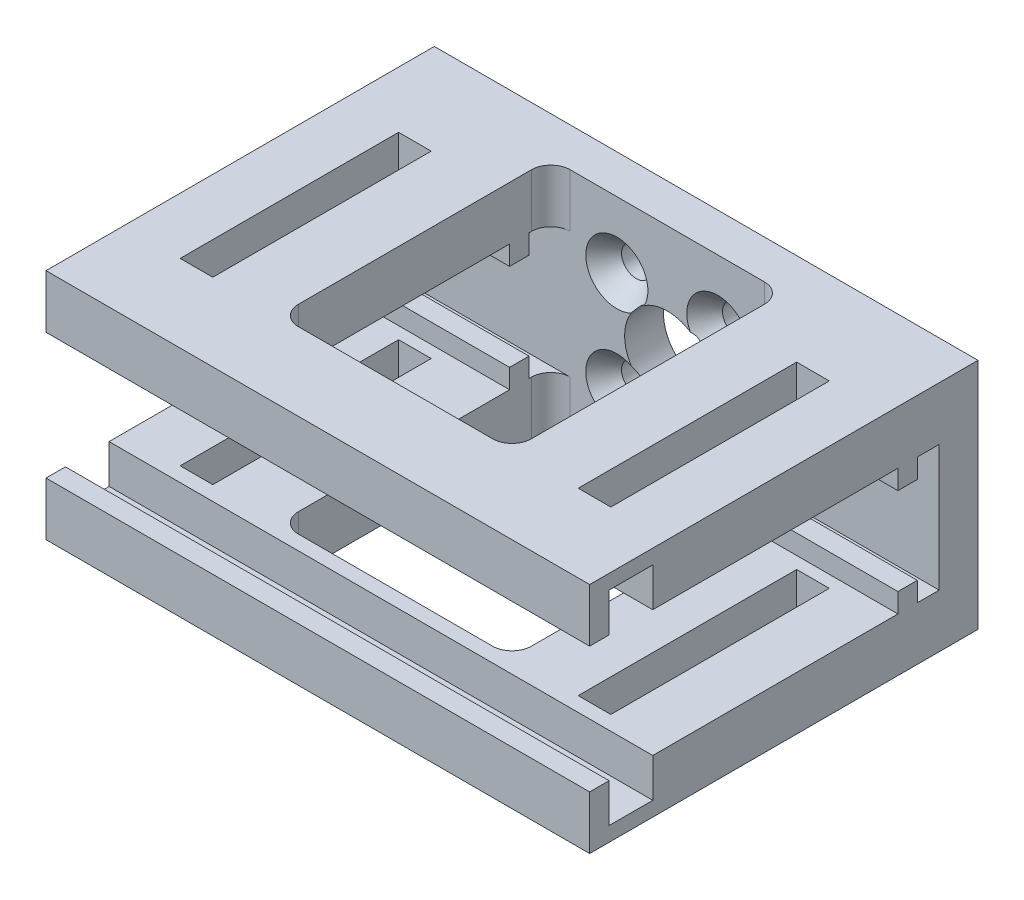
from build123d import *

# Parameters (mm, degrees)
SKETCH1_W           = 88.9
SKETCH1_H           = 63.5
BOSS_EXTRUDE1_DEPTH = 19.05
CUT_EXTRUDE1_DEPTH  = 97.302518139
SKETCH7_W           = 5.334
SKETCH7_H           = 35.71875
SKETCH7_W_2         = 38.1
SKETCH7_H_2         = 44.45
CUT_EXTRUDE4_DEPTH  = 67.599361859
SKETCH4_R           = 6.985
CUT_EXTRUDE3_DEPTH  = 75.865395878
SKETCH6_R           = 2.413
SKETCH5_R           = 5.08
CIRPATTERN1_COUNT   = 4
FILLET1_R           = 3.175


with BuildPart() as part:
    # Sketch1 → Boss-Extrude1 (new, symmetric)
    with BuildSketch(Plane(origin=(0, 0, 0), x_dir=(1, 0, 0), z_dir=(0, 1, 0))):
        Rectangle(SKETCH1_W, SKETCH1_H)
    extrude(amount=BOSS_EXTRUDE1_DEPTH, both=True)

    # Sketch3 → Cut-Extrude1 (cut, through all)
    with BuildSketch(Plane(origin=(44.45, 0, 0), x_dir=(0, 0, -1), z_dir=(1, 0, 0))):
        Polygon((-31.75, 10.31875), (-31.75, -10.31875), (-28.575, -10.31875), (-28.575, -16.66875), (-21.43125, -16.66875), (-21.43125, -10.31875), (18.653125, -10.31875), (18.653125, -7.14375), (21.828125, -7.14375), (21.828125, -10.31875), (25.4, -10.31875), (25.4, 10.31875), (21.828125, 10.31875), (21.828125, 7.14375), (18.653125, 7.14375), (18.653125, 10.31875), (-21.43125, 10.31875), (-21.43125, 16.66875), (-28.575, 16.66875), (-28.575, 10.31875), align=None)
    extrude(amount=-CUT_EXTRUDE1_DEPTH, mode=Mode.SUBTRACT)

    # Sketch7 → Cut-Extrude4 (cut, through all)
    with BuildSketch(Plane(origin=(0, 19.05, 0), x_dir=(1, 0, 0), z_dir=(0, 1, 0))):
        with Locations((-32.54375, -1.190625)):
            Rectangle(SKETCH7_W, SKETCH7_H)
        with Locations((32.54375, -1.190625)):
            Rectangle(SKETCH7_W, SKETCH7_H)
        with Locations((0, 3.175)):
            Rectangle(SKETCH7_W_2, SKETCH7_H_2)
    extrude(amount=-CUT_EXTRUDE4_DEPTH, mode=Mode.SUBTRACT)

    # Sketch4 → Cut-Extrude3 (cut, through all)
    with BuildSketch(Plane.XY.offset(-25.4)):
        Circle(SKETCH4_R)
        with BuildLine():
            ThreePointArc((-5.842, 8.255), (-9.961248663, 9.961248663), (-8.255, 5.842))
            Line((-8.255, 5.842), (-8.255, 8.255))
            Line((-8.255, 8.255), (-5.842, 8.255))
        make_face()
        with BuildLine():
            Line((-8.255, 8.255), (-8.255, 5.842))
            ThreePointArc((-8.255, 5.842), (-6.548751337, 6.548751337), (-5.842, 8.255))
            Line((-5.842, 8.255), (-8.255, 8.255))
        make_face()
        with BuildLine():
            ThreePointArc((5.842, 8.255), (6.548751337, 6.548751337), (8.255, 5.842))
            Line((8.255, 5.842), (8.255, 8.255))
            Line((8.255, 8.255), (5.842, 8.255))
        make_face()
        with BuildLine():
            Line((8.255, 8.255), (8.255, 5.842))
            ThreePointArc((8.255, 5.842), (9.961248663, 6.548751337), (10.668, 8.255))
            ThreePointArc((10.668, 8.255), (8.255, 10.668), (5.842, 8.255))
            Line((5.842, 8.255), (8.255, 8.255))
        make_face()
        with BuildLine():
            ThreePointArc((8.255, -5.842), (6.548751337, -6.548751337), (5.842, -8.255))
            Line((5.842, -8.255), (8.255, -8.255))
            Line((8.255, -8.255), (8.255, -5.842))
        make_face()
        with BuildLine():
            Line((8.255, -8.255), (5.842, -8.255))
            ThreePointArc((5.842, -8.255), (8.255, -10.668), (10.668, -8.255))
            ThreePointArc((10.668, -8.255), (9.961248663, -6.548751337), (8.255, -5.842))
            Line((8.255, -5.842), (8.255, -8.255))
        make_face()
        with BuildLine():
            ThreePointArc((-8.255, -5.842), (-9.961248663, -9.961248663), (-5.842, -8.255))
            Line((-5.842, -8.255), (-8.255, -8.255))
            Line((-8.255, -8.255), (-8.255, -5.842))
        make_face()
        with BuildLine():
            Line((-8.255, -8.255), (-5.842, -8.255))
            ThreePointArc((-5.842, -8.255), (-6.548751337, -6.548751337), (-8.255, -5.842))
            Line((-8.255, -5.842), (-8.255, -8.255))
        make_face()
    extrude(amount=-CUT_EXTRUDE3_DEPTH, mode=Mode.SUBTRACT)

    # Sketch6 → Cut-Loft2 section 0
    with BuildSketch(Plane.XY.offset(-28.575)):
        with Locations((-8.255, 8.255)):
            Circle(SKETCH6_R)
    # Sketch5 → Cut-Loft2 section 1
    with BuildSketch(Plane.XY.offset(-25.4)):
        with Locations((-8.255, 8.255)):
            Circle(SKETCH5_R)
    cut_loft2 = loft(mode=Mode.SUBTRACT)

    # CirPattern1: Cut-Loft2 ×4 about axis
    cirpattern1_axis = Axis((0, 0, 0), (0, 0, 1))
    for i in range(1, CIRPATTERN1_COUNT):
        add(cut_loft2.rotate(cirpattern1_axis, i * 360 / CIRPATTERN1_COUNT), mode=Mode.SUBTRACT)

    # Fillet1
    fillet1_edges = [part.edges().sort_by_distance(p)[0] for p in [
        (19.05, -14.684375, 19.05),
        (-19.05, -14.684375, 19.05),
        (-19.05, -14.684375, -25.4),
        (19.05, -14.684375, -25.4),
        (-19.05, 14.684375, 19.05),
        (-19.05, 14.684375, -25.4),
        (19.05, 14.684375, -25.4),
        (19.05, 14.684375, 19.05),
    ]]
    fillet(fillet1_edges, radius=FILLET1_R)


solid = part.part
